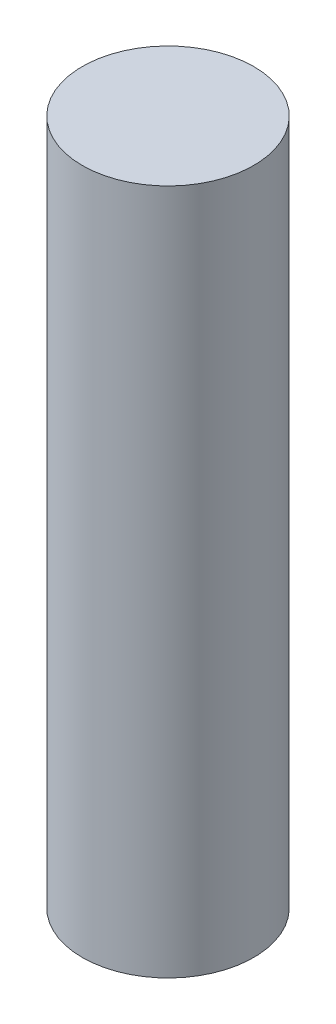
from build123d import *

# Parameters (mm, degrees)
SKETCH1_R           = 5
BOSS_EXTRUDE1_DEPTH = 40


with BuildPart() as part:
    # Sketch1 → Boss-Extrude1 (new body)
    with BuildSketch(Plane(origin=(0, 0, 0), x_dir=(1, 0, 0), z_dir=(0, 1, 0))):
        with Locations(Location((0, 0, 0), (0, 0, 270))):
            Circle(SKETCH1_R)
    extrude(amount=BOSS_EXTRUDE1_DEPTH)


solid = part.part
